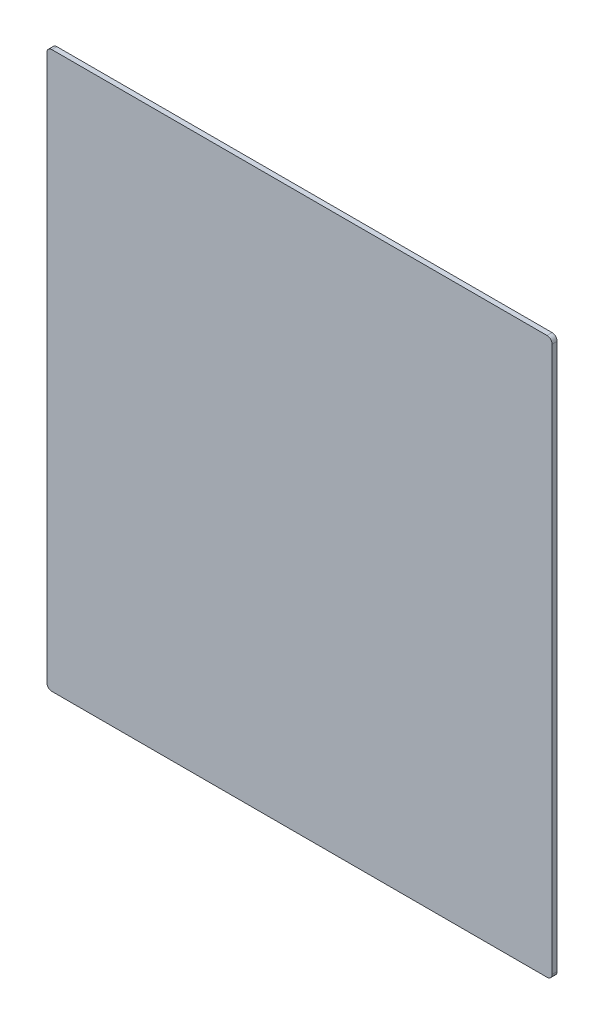
from build123d import *

# Parameters (mm, degrees)
SKETCH_1_W      = 300
SKETCH_1_H      = 330
EXTRUDE_1_DEPTH = 3
FILLET_1_R      = 3


with BuildPart() as part:
    # 草图1 → 凸台-拉伸1 (new body)
    with BuildSketch(Plane.XY):
        with Locations((150, 165)):
            Rectangle(SKETCH_1_W, SKETCH_1_H)
    extrude(amount=EXTRUDE_1_DEPTH)

    # 圆角1
    fillet_1_edges = [part.edges().sort_by_distance(p)[0] for p in [
        (0, 330, 1.5),
        (300, 330, 1.5),
        (300, 0, 1.5),
        (0, 0, 1.5),
    ]]
    fillet(fillet_1_edges, radius=FILLET_1_R)


solid = part.part
